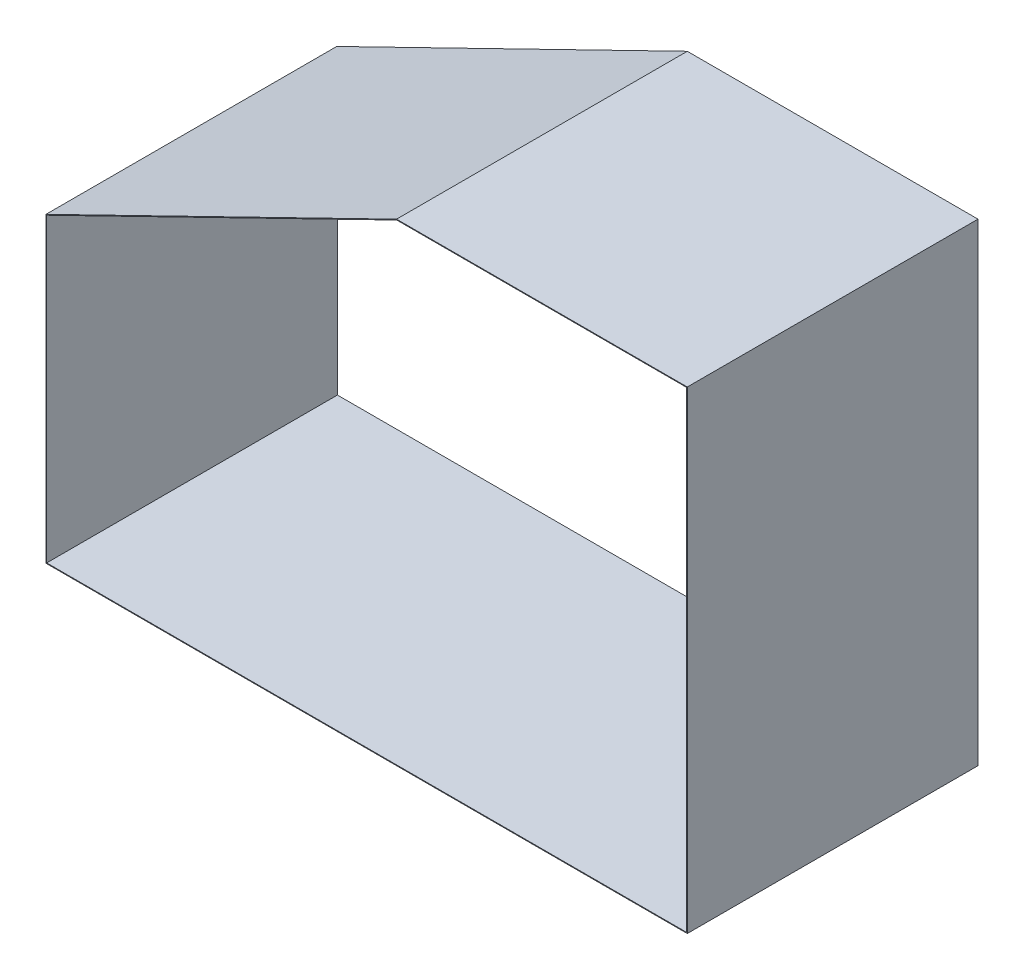
from build123d import *

# Parameters (mm, degrees)
BOSS_EXTRUDE1_DEPTH = 1013.2


with BuildPart() as part:
    # Sketch1 → Boss-Extrude1 (new body)
    with BuildSketch(Plane.XY):
        Polygon((1221.8, 1649.71), (2235, 1649.71), (2235, 0), (0, 0), (0, 1053.44), align=None)
        Polygon((2.5, 1051.878238321), (1222.377482381, 1647.21), (2232.5, 1647.21), (2232.5, 2.5), (2.5, 2.5), align=None, mode=Mode.SUBTRACT)
    extrude(amount=BOSS_EXTRUDE1_DEPTH)


solid = part.part
